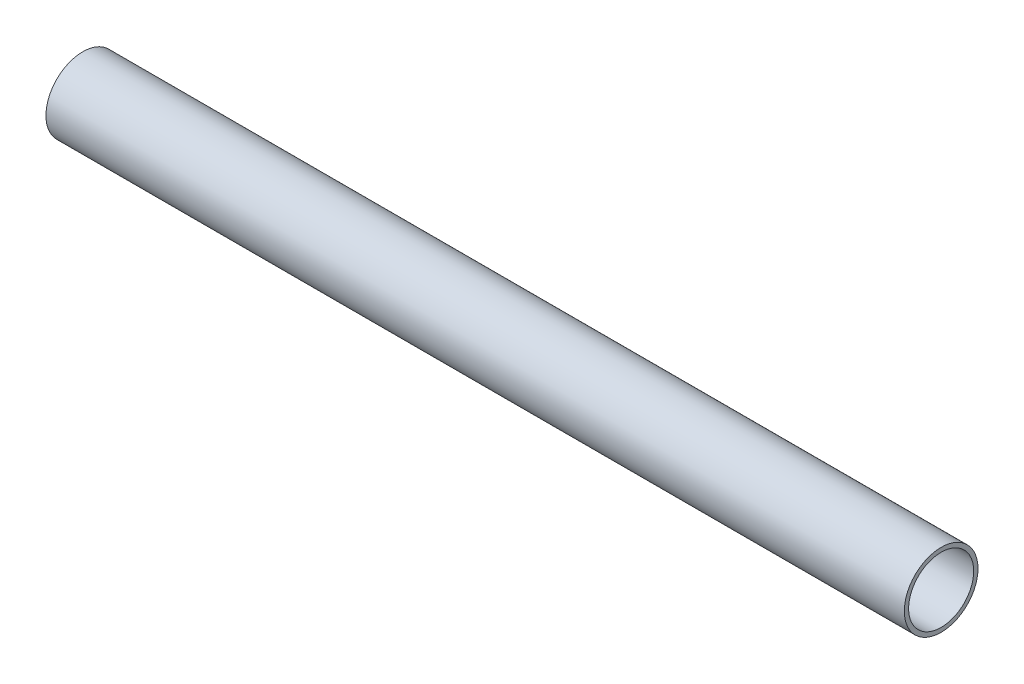
from build123d import *

# Parameters (mm, degrees)
CROQUIS2_R              = 85.85
CROQUIS2_R_2            = 75.85
SALIENTE_EXTRUIR1_DEPTH = 2000


with BuildPart() as part:
    # Croquis2 → Saliente-Extruir1 (new body)
    with BuildSketch(Plane(origin=(0, 0, 0), x_dir=(0, 0, -1), z_dir=(1, 0, 0))):
        Circle(CROQUIS2_R)
        Circle(CROQUIS2_R_2, mode=Mode.SUBTRACT)
    extrude(amount=SALIENTE_EXTRUIR1_DEPTH)


solid = part.part
